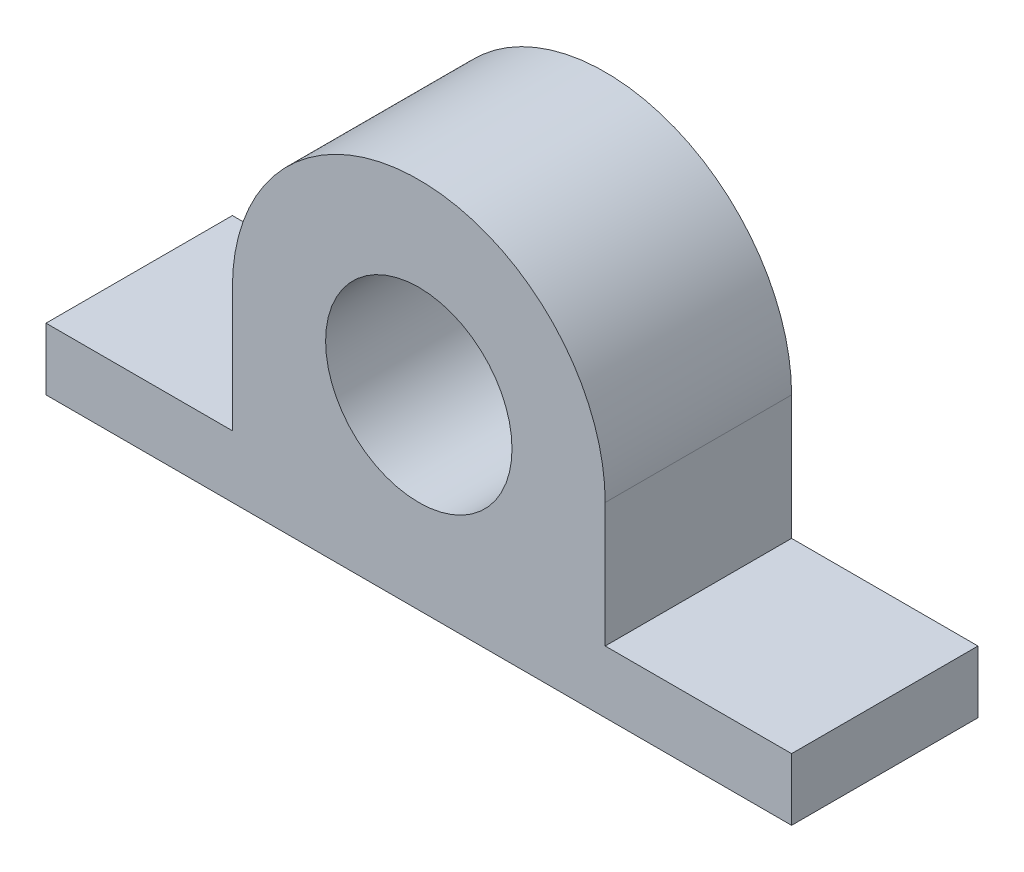
from build123d import *

# Parameters (mm, degrees)
SKETCH1_R           = 15
BOSS_EXTRUDE1_DEPTH = 30


with BuildPart() as part:
    # Sketch1 → Boss-Extrude1 (new body)
    with BuildSketch(Plane.XY):
        with BuildLine():
            Line((30, 25), (30, 5))
            Line((30, 5), (60, 5))
            Line((60, 5), (60, -5))
            Line((60, -5), (-60, -5))
            Line((-60, -5), (-60, 5))
            Line((-60, 5), (-30, 5))
            Line((-30, 5), (-30, 25))
            ThreePointArc((-30, 25), (0, 55), (30, 25))
        make_face()
        with Locations((0, 25)):
            Circle(SKETCH1_R, mode=Mode.SUBTRACT)
    extrude(amount=BOSS_EXTRUDE1_DEPTH)


solid = part.part
